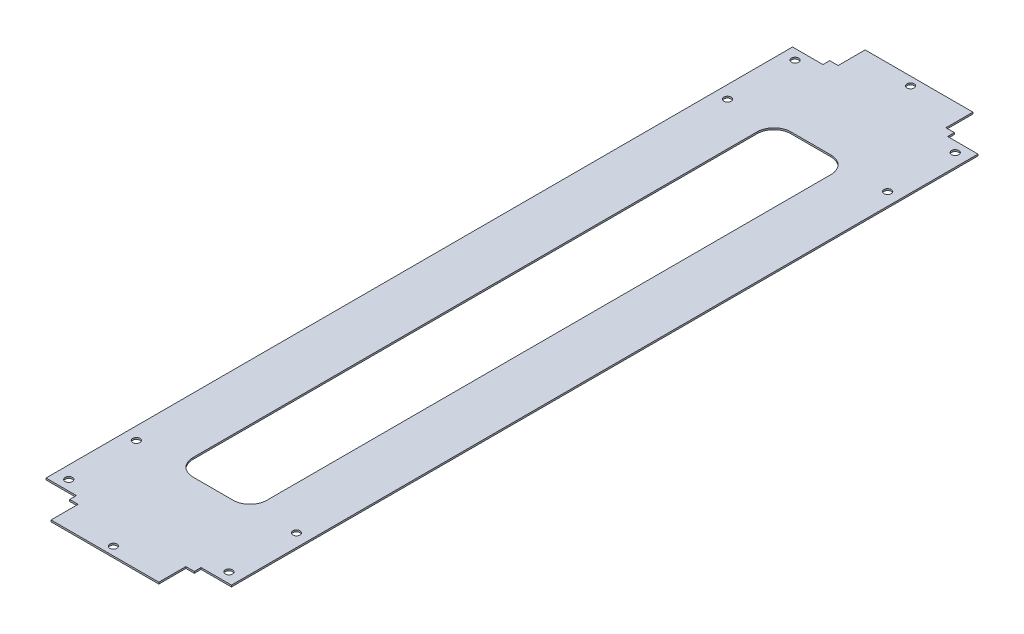
from build123d import *

# Parameters (mm, degrees)
SKETCH1_R           = 2.15
SKETCH1_W           = 43.8
SKETCH1_H           = 354
BOSS_EXTRUDE1_DEPTH = 1
FILLET2_R           = 10


with BuildPart() as part:
    # Sketch1 → Boss-Extrude1 (new body)
    with BuildSketch(Plane(origin=(0, 0, 0), x_dir=(1, 0, 0), z_dir=(0, 1, 0))):
        Polygon((-54.9, -221), (-36.9, -221), (-36.9, -225), (-31.9, -225), (-31.9, -241), (31.9, -241), (31.9, -225), (36.9, -225), (36.9, -221), (54.9, -221), (54.9, 221), (36.9, 221), (36.9, 225), (31.9, 225), (31.9, 241), (-31.9, 241), (-31.9, 225), (-36.9, 225), (-36.9, 221), (-54.9, 221), align=None)
        with Locations(Location((-47.4, 175, 0), (0, 0, 270))):
            Circle(SKETCH1_R, mode=Mode.SUBTRACT)
        with Locations(Location((47.4, 175, 0), (0, 0, 270))):
            Circle(SKETCH1_R, mode=Mode.SUBTRACT)
        with Locations(Location((-47.4, -175, 0), (0, 0, 270))):
            Circle(SKETCH1_R, mode=Mode.SUBTRACT)
        with Locations(Location((47.4, -175, 0), (0, 0, 270))):
            Circle(SKETCH1_R, mode=Mode.SUBTRACT)
        with Locations(Location((-47.4, -215, 0), (0, 0, 270))):
            Circle(SKETCH1_R, mode=Mode.SUBTRACT)
        with Locations(Location((47.4, -215, 0), (0, 0, 270))):
            Circle(SKETCH1_R, mode=Mode.SUBTRACT)
        with Locations(Location((47.4, 215, 0), (0, 0, 270))):
            Circle(SKETCH1_R, mode=Mode.SUBTRACT)
        with Locations(Location((-47.4, 215, 0), (0, 0, 270))):
            Circle(SKETCH1_R, mode=Mode.SUBTRACT)
        with Locations(Location((0, 236, 0), (0, 0, 270))):
            Circle(SKETCH1_R, mode=Mode.SUBTRACT)
        with Locations(Location((0, -236, 0), (0, 0, 270))):
            Circle(SKETCH1_R, mode=Mode.SUBTRACT)
        Rectangle(SKETCH1_W, SKETCH1_H, mode=Mode.SUBTRACT)
    extrude(amount=BOSS_EXTRUDE1_DEPTH)

    # Fillet2
    fillet2_edges = [part.edges().sort_by_distance(p)[0] for p in [
        (21.9, 0.5, 177),
        (21.9, 0.5, -177),
        (-21.9, 0.5, -177),
        (-21.9, 0.5, 177),
    ]]
    fillet(fillet2_edges, radius=FILLET2_R)


solid = part.part
